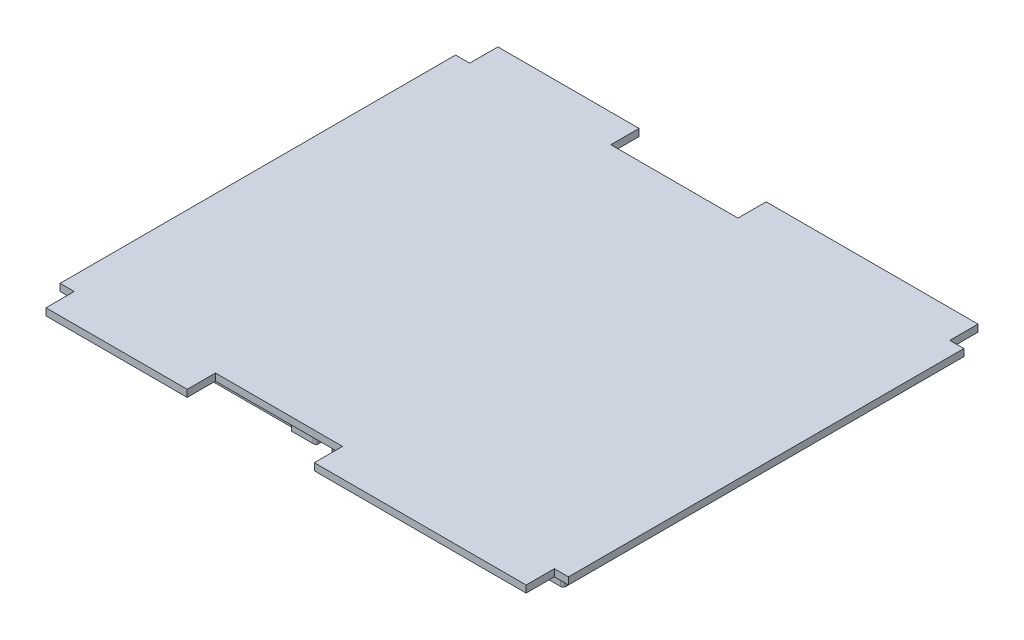
from build123d import *

# Parameters (mm, degrees)
BOSS_EXTRUDE1_DEPTH = 6.35
BOSS_EXTRUDE2_DEPTH = 12.7
FILLET1_R           = 2.54


with BuildPart() as part:
    # Sketch1 → Boss-Extrude1 (new body)
    with BuildSketch(Plane(origin=(0, 0, 0), x_dir=(1, 0, 0), z_dir=(0, 1, 0))):
        Polygon((-228.6, 177.8), (-228.6, -177.8), (-215.9, -177.8), (-215.9, -203.2), (-88.9, -203.2), (-88.9, -177.8), (25.4, -177.8), (25.4, -203.2), (215.9, -203.2), (215.9, -177.8), (228.6, -177.8), (228.6, 177.8), (215.9, 177.8), (215.9, 203.2), (25.4, 203.2), (25.4, 177.8), (-88.9, 177.8), (-88.9, 203.2), (-215.9, 203.2), (-215.9, 177.8), align=None)
    extrude(amount=BOSS_EXTRUDE1_DEPTH)

    # Sketch2 → Boss-Extrude2 (add)
    with BuildSketch(Plane.XZ):
        Polygon((-193.675, 3.17500545), (-193.675, 6.35000545), (-28.575, 6.35000545), (-28.575, 3.17500545), (-6.35, 3.174999665), (-6.35, 169.862499665), (-28.575, 169.862500389), (-28.575, 166.687500389), (-193.675, 166.687500389), (-193.675, 169.862500389), (-215.9, 169.8625), (-215.9, 3.175), align=None)
        Polygon((-6.35, -3.174999665), (-6.35, -169.862499665), (-28.575, -169.862500389), (-28.575, -166.687500389), (-193.675, -166.687500389), (-193.675, -169.862500389), (-215.9, -169.8625), (-215.9, -3.175), (-193.675, -3.17500545), (-193.675, -6.35000545), (-28.575, -6.35000545), (-28.575, -3.17500545), align=None)
        Polygon((193.675, -3.17500545), (193.675, -6.35000545), (28.575, -6.35000545), (28.575, -3.17500545), (6.35, -3.174999665), (6.35, -169.862499665), (28.575, -169.862500389), (28.575, -166.687500389), (193.675, -166.687500389), (193.675, -169.862500389), (215.9, -169.8625), (215.9, -3.175), align=None)
        Polygon((6.35, 3.174999665), (6.35, 169.862499665), (28.575, 169.862500389), (28.575, 166.687500389), (193.675, 166.687500389), (193.675, 169.862500389), (215.9, 169.8625), (215.9, 3.175), (193.675, 3.17500545), (193.675, 6.35000545), (28.575, 6.35000545), (28.575, 3.17500545), align=None)
    extrude(amount=BOSS_EXTRUDE2_DEPTH)

    # Fillet1
    fillet1_edges = [part.edges().sort_by_distance(p)[0] for p in [
        (215.9, -6.35, -169.8625),
        (215.9, -6.35, -3.175),
        (6.35, -6.35, -3.174999665),
        (6.35, -6.35, -169.862499665),
        (-215.9, -6.35, 169.8625),
        (-215.9, -6.35, 3.175),
        (-6.35, -6.35, 3.174999665),
        (-6.35, -6.35, 169.862499665),
        (215.9, -6.35, 169.8625),
        (6.35, -6.35, 169.862499665),
        (6.35, -6.35, 3.174999665),
        (215.9, -6.35, 3.175),
        (-215.9, -6.35, -169.8625),
        (-6.35, -6.35, -169.862499665),
        (-6.35, -6.35, -3.174999665),
        (-215.9, -6.35, -3.175),
    ]]
    fillet(fillet1_edges, radius=FILLET1_R)


solid = part.part
